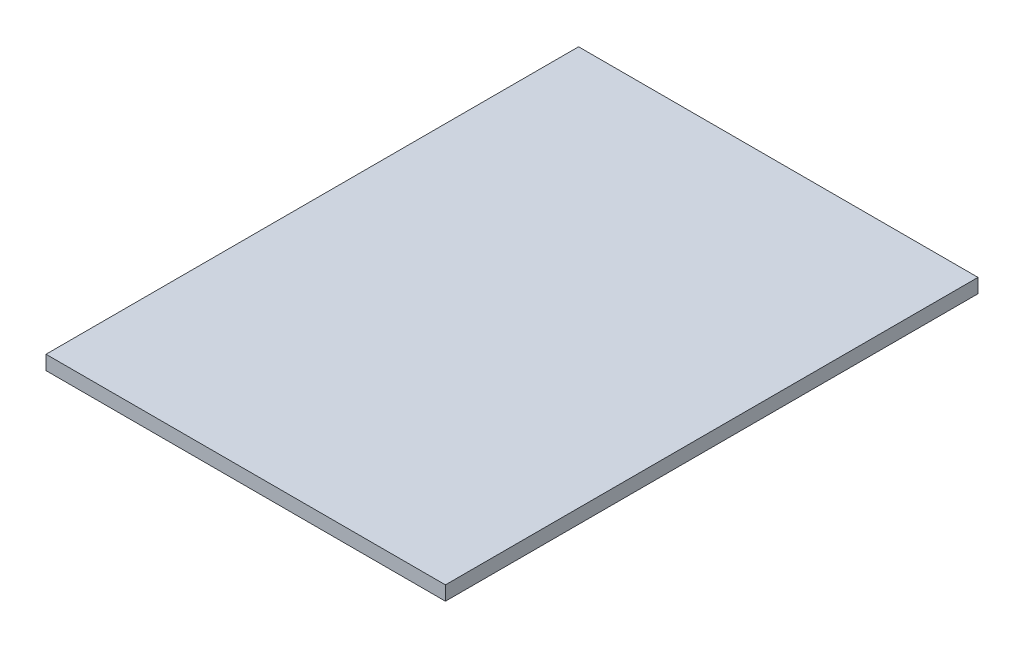
from build123d import *

# Parameters (mm, degrees)
SKETCH1_W           = 450
SKETCH1_H           = 600
BOSS_EXTRUDE1_DEPTH = 16


with BuildPart() as part:
    # Sketch1 → Boss-Extrude1 (new body)
    with BuildSketch(Plane(origin=(0, 0, 0), x_dir=(1, 0, 0), z_dir=(0, 1, 0))):
        Rectangle(SKETCH1_W, SKETCH1_H)
    extrude(amount=BOSS_EXTRUDE1_DEPTH)


solid = part.part
